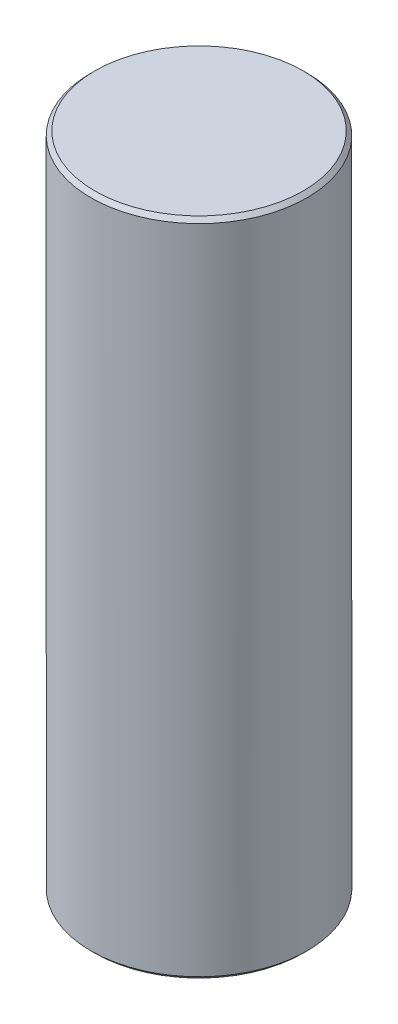
from build123d import *

# Parameters (mm, degrees)
SKETCH_1_R      = 27.5
EXTRUDE_1_DEPTH = 168
CHAMFER_1_SIZE  = 1


with BuildPart() as part:
    # 草图1 → 凸台-拉伸1 (new body)
    with BuildSketch(Plane(origin=(0, 0, 0), x_dir=(1, 0, 0), z_dir=(0, 1, 0))):
        with Locations(Location((0, 0, 0), (0, 0, 90))):
            Circle(SKETCH_1_R)
    extrude(amount=EXTRUDE_1_DEPTH)

    # 倒角1
    chamfer_1_edges = [part.edges().sort_by_distance(p)[0] for p in [
        (0, 0, 27.5),
        (0, 168, 27.5),
    ]]
    chamfer(chamfer_1_edges, length=CHAMFER_1_SIZE)


solid = part.part
